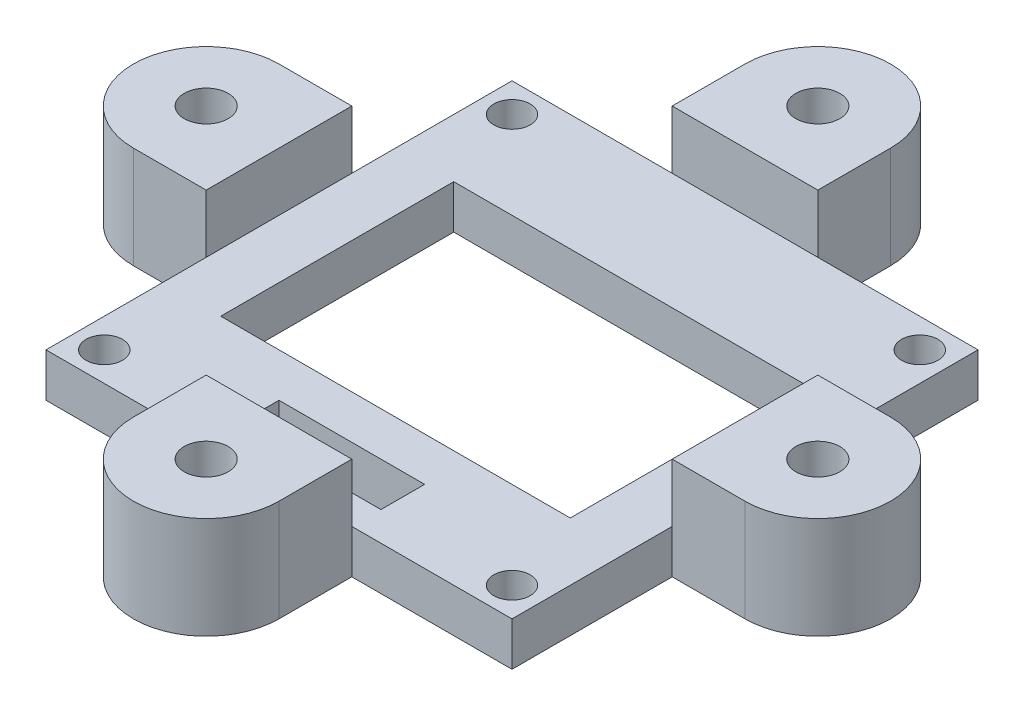
from build123d import *

# Parameters (mm, degrees)
SKETCH_2_R          = 1.25
SKETCH_2_R_2        = 1.51
EXTRUDE_1_DEPTH     = 3
SKETCH_4_R          = 1.51
EXTRUDE_2_DEPTH     = 4.5
SKETCH_5_R          = 1.51
EXTRUDE_3_DEPTH     = 4.5
SKETCH_7_W          = 94.013150519
SKETCH_7_H          = 65.926721802
CUT_EXTRUDE_1_DEPTH = 0.5


with BuildPart() as part:
    # 草图2 → 凸台-拉伸1 (new body)
    with BuildSketch(Plane(origin=(0, 0, 0), x_dir=(1, 0, 0), z_dir=(0, 1, 0))):
        with BuildLine():
            Line((21, 5), (16, 5))
            Line((16, 5), (16, 16))
            Line((16, 16), (5, 16))
            Line((5, 16), (5, 21))
            ThreePointArc((5, 21), (0, 26), (-5, 21))
            Line((-5, 21), (-5, 16))
            Line((-5, 16), (-16, 16))
            Line((-16, 16), (-16, 5))
            Line((-16, 5), (-21, 5))
            ThreePointArc((-21, 5), (-26, 0), (-21, -5))
            Line((-21, -5), (-16, -5))
            Line((-16, -5), (-16, -16))
            Line((-16, -16), (-5, -16))
            Line((-5, -16), (-5, -21))
            ThreePointArc((-5, -21), (0, -26), (5, -21))
            Line((5, -21), (5, -16))
            Line((5, -16), (16, -16))
            Line((16, -16), (16, -5))
            Line((16, -5), (21, -5))
            ThreePointArc((21, -5), (26, 0), (21, 5))
        make_face()
        with Locations(Location((-14, 14, 0), (0, 0, 270))):
            Circle(SKETCH_2_R, mode=Mode.SUBTRACT)
        with Locations(Location((14, 14, 0), (0, 0, 270))):
            Circle(SKETCH_2_R, mode=Mode.SUBTRACT)
        with Locations(Location((14, -14, 0), (0, 0, 270))):
            Circle(SKETCH_2_R, mode=Mode.SUBTRACT)
        with Locations(Location((-14, -14, 0), (0, 0, 270))):
            Circle(SKETCH_2_R, mode=Mode.SUBTRACT)
        with Locations(Location((21, 0, 0), (0, 0, 270))):
            Circle(SKETCH_2_R_2, mode=Mode.SUBTRACT)
        with Locations(Location((0, 21, 0), (0, 0, 270))):
            Circle(SKETCH_2_R_2, mode=Mode.SUBTRACT)
        with Locations(Location((0, -21, 0), (0, 0, 270))):
            Circle(SKETCH_2_R_2, mode=Mode.SUBTRACT)
        with Locations(Location((-21, 0, 0), (0, 0, 270))):
            Circle(SKETCH_2_R_2, mode=Mode.SUBTRACT)
        Polygon((-12, 0), (-12, 8), (12, 8), (12, 0), (12, -8), (-12, -8), align=None, mode=Mode.SUBTRACT)
        Polygon((0, -11), (5, -11), (5, -14), (0, -14), (-5, -14), (-5, -11), align=None, mode=Mode.SUBTRACT)
    extrude(amount=EXTRUDE_1_DEPTH)

    # 草图4 → 凸台-拉伸2 (add)
    with BuildSketch(Plane(origin=(0, 3, 0), x_dir=(1, 0, 0), z_dir=(0, 1, 0))):
        with BuildLine():
            Line((-16, -5), (-16, 5))
            Line((-16, 5), (-21, 5))
            ThreePointArc((-21, 5), (-26, 0), (-21, -5))
            Line((-21, -5), (-16, -5))
        make_face()
        with Locations(Location((-21, 0, 0), (0, 0, 270))):
            Circle(SKETCH_4_R, mode=Mode.SUBTRACT)
    extrude(amount=EXTRUDE_2_DEPTH)

    # 草图5 → 凸台-拉伸3 (add)
    # profile 1 of 3: a face of its own
    with BuildSketch(Plane(origin=(0, 3, 0), x_dir=(1, 0, 0), z_dir=(0, 1, 0))):
        with BuildLine():
            Line((-5, 16), (5, 16))
            Line((5, 16), (5, 21))
            ThreePointArc((5, 21), (0, 26), (-5, 21))
            Line((-5, 21), (-5, 16))
        make_face()
        with Locations(Location((0, 21, 0), (0, 0, 270))):
            Circle(SKETCH_5_R, mode=Mode.SUBTRACT)
    # profile 2 of 3: a face of its own
    with BuildSketch(Plane(origin=(0, 3, 0), x_dir=(1, 0, 0), z_dir=(0, 1, 0))):
        with BuildLine():
            Line((16, -5), (16, 5))
            Line((16, 5), (21, 5))
            ThreePointArc((21, 5), (26, 0), (21, -5))
            Line((21, -5), (16, -5))
        make_face()
        with Locations(Location((21, 0, 0), (0, 0, 270))):
            Circle(SKETCH_5_R, mode=Mode.SUBTRACT)
    # profile 3 of 3: a face of its own
    with BuildSketch(Plane(origin=(0, 3, 0), x_dir=(1, 0, 0), z_dir=(0, 1, 0))):
        with BuildLine():
            Line((-5, -16), (5, -16))
            Line((5, -16), (5, -21))
            ThreePointArc((5, -21), (0, -26), (-5, -21))
            Line((-5, -21), (-5, -16))
        make_face()
        with Locations(Location((0, -21, 0), (0, 0, 270))):
            Circle(SKETCH_5_R, mode=Mode.SUBTRACT)
    extrude(amount=EXTRUDE_3_DEPTH)

    # 草图7 → 切除-拉伸1 (cut)
    with BuildSketch(Plane(origin=(0, 7.5, 0), x_dir=(1, 0, 0), z_dir=(0, 1, 0))):
        with Locations((4.289349993, -0.293791095)):
            Rectangle(SKETCH_7_W, SKETCH_7_H)
    extrude(amount=-CUT_EXTRUDE_1_DEPTH, mode=Mode.SUBTRACT)


solid = part.part
